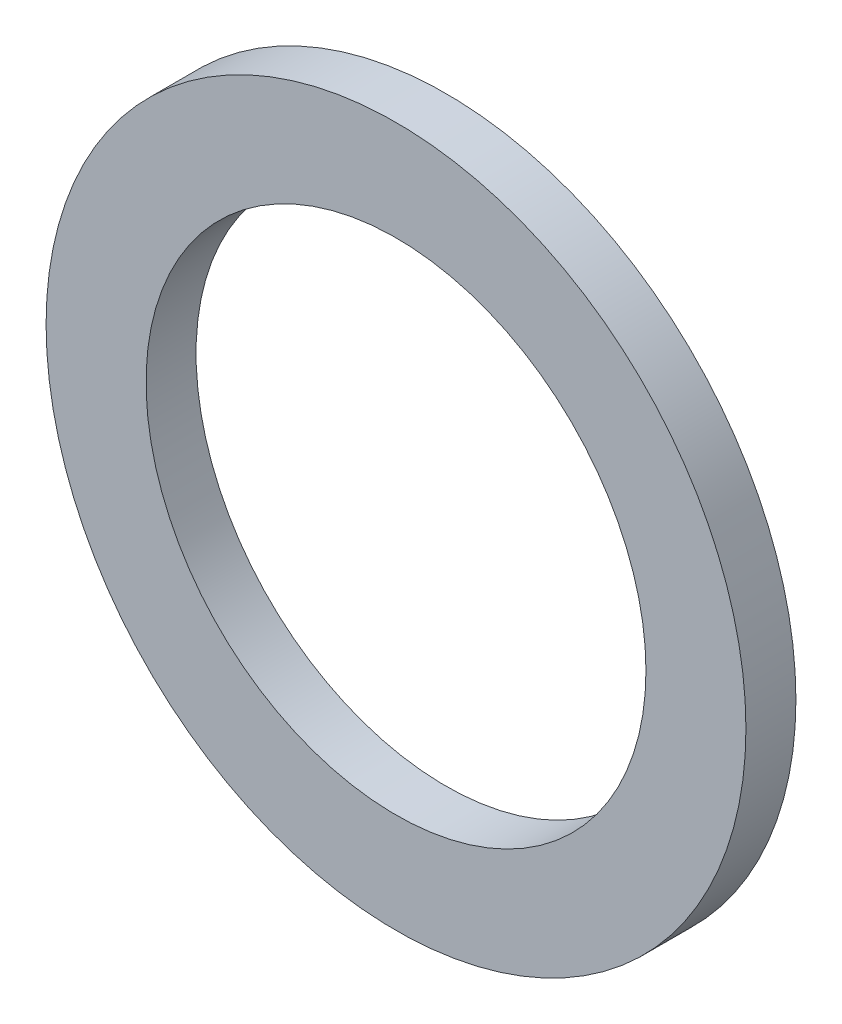
from build123d import *

# Parameters (mm, degrees)
SKETCH1_R           = 3.5
SKETCH1_R_2         = 2.5
BOSS_EXTRUDE1_DEPTH = 0.5


with BuildPart() as part:
    # Sketch1 → Boss-Extrude1 (new body)
    with BuildSketch(Plane.XY):
        Circle(SKETCH1_R)
        Circle(SKETCH1_R_2, mode=Mode.SUBTRACT)
    extrude(amount=BOSS_EXTRUDE1_DEPTH)


solid = part.part
